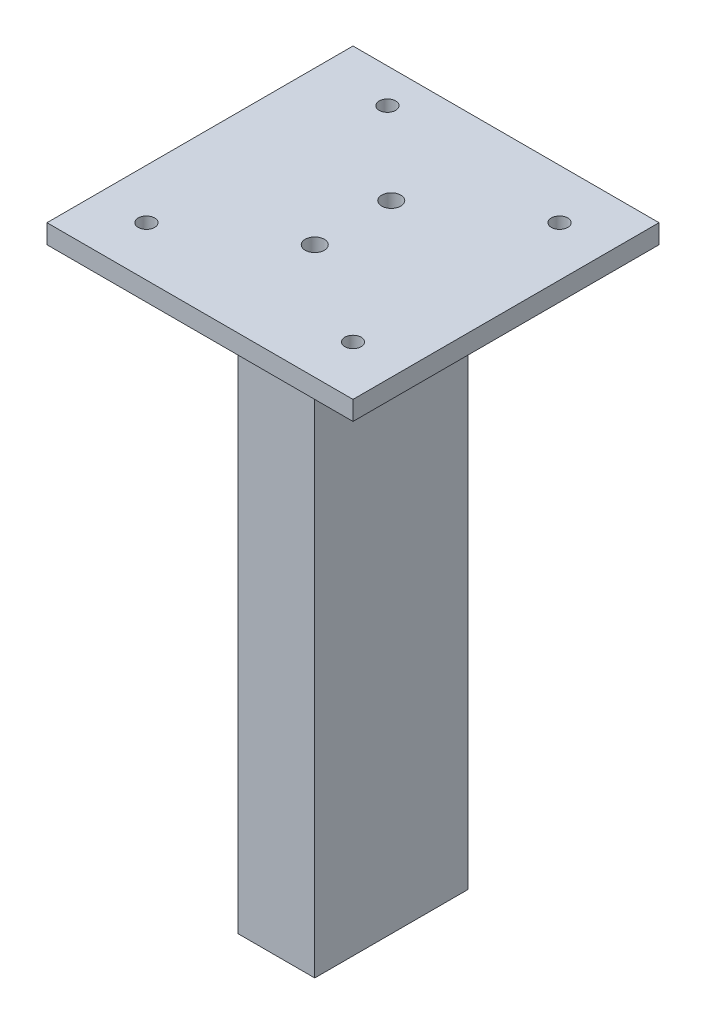
from build123d import *

# Parameters (mm, degrees)
SKETCH1_W           = 20
SKETCH1_H           = 40
BOSS_EXTRUDE1_DEPTH = 151
SKETCH2_W           = 80
SKETCH2_H           = 80
BOSS_EXTRUDE2_DEPTH = 5
SKETCH3_R           = 2.5
CUT_EXTRUDE1_DEPTH  = 166.939748102
CUT_EXTRUDE2_REACH  = 167.94
SKETCH4_R           = 2.15


with BuildPart() as part:
    # Sketch1 → Boss-Extrude1 (new body)
    with BuildSketch(Plane(origin=(0, 0, 0), x_dir=(1, 0, 0), z_dir=(0, 1, 0))):
        Rectangle(SKETCH1_W, SKETCH1_H)
    extrude(amount=BOSS_EXTRUDE1_DEPTH)

    # Sketch2 → Boss-Extrude2 (add)
    with BuildSketch(Plane(origin=(0, 151, 0), x_dir=(1, 0, 0), z_dir=(0, 1, 0))):
        Rectangle(SKETCH2_W, SKETCH2_H)
    extrude(amount=BOSS_EXTRUDE2_DEPTH)

    # Sketch3 → Cut-Extrude1 (cut, through all)
    with BuildSketch(Plane(origin=(0, 156, 0), x_dir=(1, 0, 0), z_dir=(0, 1, 0))):
        with Locations(Location((0, 10, 0), (0, 0, 270))):
            Circle(SKETCH3_R)
        with Locations(Location((0, -10, 0), (0, 0, 270))):
            Circle(SKETCH3_R)
    extrude(amount=-CUT_EXTRUDE1_DEPTH, mode=Mode.SUBTRACT)

    # Sketch4 → Cut-Extrude2 (cut, up to next)
    with BuildSketch(Plane(origin=(0, 156, 0), x_dir=(1, 0, 0), z_dir=(0, 1, 0)), mode=Mode.PRIVATE) as cut_extrude2_sk1:
        with Locations(Location((-22, 31, 0), (0, 0, 270))):
            Circle(SKETCH4_R)
    cut_extrude2_tool1 = extrude(cut_extrude2_sk1.sketch, amount=-CUT_EXTRUDE2_REACH, mode=Mode.PRIVATE) & part.part
    # Sketch4 → Cut-Extrude2 (cut, up to next)
    with BuildSketch(Plane(origin=(0, 156, 0), x_dir=(1, 0, 0), z_dir=(0, 1, 0)), mode=Mode.PRIVATE) as cut_extrude2_sk2:
        with Locations(Location((27, 27, 0), (0, 0, 270))):
            Circle(SKETCH4_R)
    cut_extrude2_tool2 = extrude(cut_extrude2_sk2.sketch, amount=-CUT_EXTRUDE2_REACH, mode=Mode.PRIVATE) & part.part
    # Sketch4 → Cut-Extrude2 (cut, up to next)
    with BuildSketch(Plane(origin=(0, 156, 0), x_dir=(1, 0, 0), z_dir=(0, 1, 0)), mode=Mode.PRIVATE) as cut_extrude2_sk3:
        with Locations(Location((-27, -27, 0), (0, 0, 270))):
            Circle(SKETCH4_R)
    cut_extrude2_tool3 = extrude(cut_extrude2_sk3.sketch, amount=-CUT_EXTRUDE2_REACH, mode=Mode.PRIVATE) & part.part
    # Sketch4 → Cut-Extrude2 (cut, up to next)
    with BuildSketch(Plane(origin=(0, 156, 0), x_dir=(1, 0, 0), z_dir=(0, 1, 0)), mode=Mode.PRIVATE) as cut_extrude2_sk4:
        with Locations(Location((27, -27, 0), (0, 0, 270))):
            Circle(SKETCH4_R)
    cut_extrude2_tool4 = extrude(cut_extrude2_sk4.sketch, amount=-CUT_EXTRUDE2_REACH, mode=Mode.PRIVATE) & part.part
    add(cut_extrude2_tool1.solids().sort_by_distance((-22, 156, -31))[0], mode=Mode.SUBTRACT)
    add(cut_extrude2_tool2.solids().sort_by_distance((27, 156, -27))[0], mode=Mode.SUBTRACT)
    add(cut_extrude2_tool3.solids().sort_by_distance((-27, 156, 27))[0], mode=Mode.SUBTRACT)
    add(cut_extrude2_tool4.solids().sort_by_distance((27, 156, 27))[0], mode=Mode.SUBTRACT)


solid = part.part
